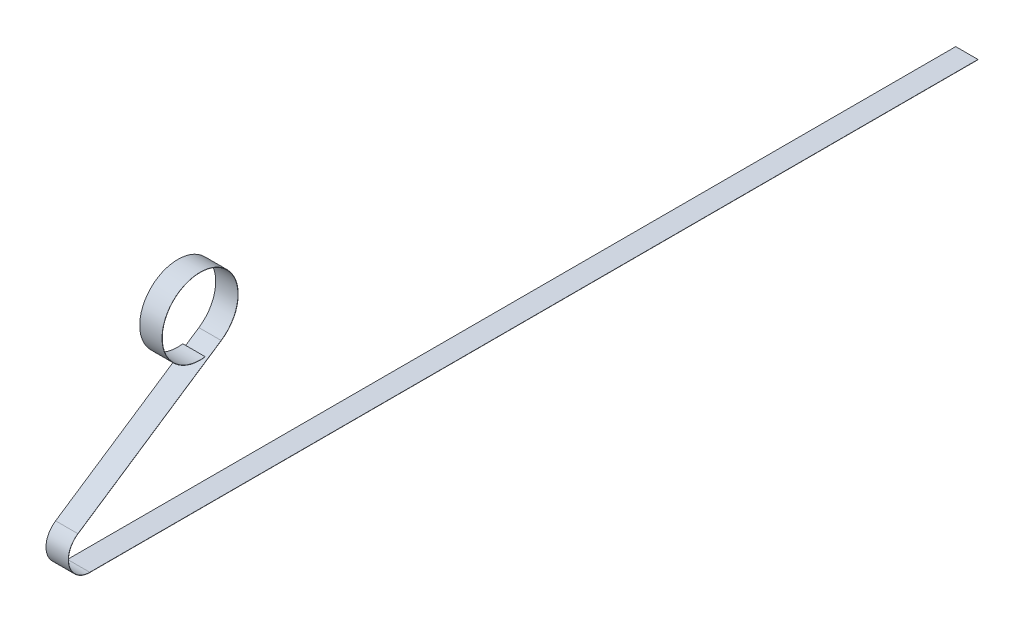
from build123d import *

# Parameters (mm, degrees)
SKETCH1_W           = 25.4
SKETCH1_H           = 0.254
BOSS_EXTRUDE1_DEPTH = 1012.444
SKETCH3_W           = 25.4
SKETCH3_H           = 0.254


with BuildPart() as part:
    # Sketch1 → Boss-Extrude1 (new body)
    with BuildSketch(Plane.XY):
        with Locations((12.7, 0.127)):
            Rectangle(SKETCH1_W, SKETCH1_H)
    extrude(amount=BOSS_EXTRUDE1_DEPTH)

    # Sweep12: sweep along a path in Sketch5
    with BuildLine(Plane(origin=(0, 0, 0), x_dir=(0, 0, -1), z_dir=(1, 0, 0))) as sweep12_path:
        ThreePointArc((-880.897498734, 147.072202414), (-902.023368964, 230.752034475), (-862.54915142, 154.003074639))
        Line((-862.54915142, 154.003074639), (-1025.857747632, 44.913935374))
        ThreePointArc((-1025.857747632, 44.913935374), (-1035.666679092, 17.623395262), (-1012.444, 0.254))
    # Sketch3 → Sweep12 (sweep)
    with BuildSketch(Plane.XY.offset(1012.444)):
        with Locations((12.7, 0.127)):
            Rectangle(SKETCH3_W, SKETCH3_H)
    sweep(path=sweep12_path.line)


solid = part.part
